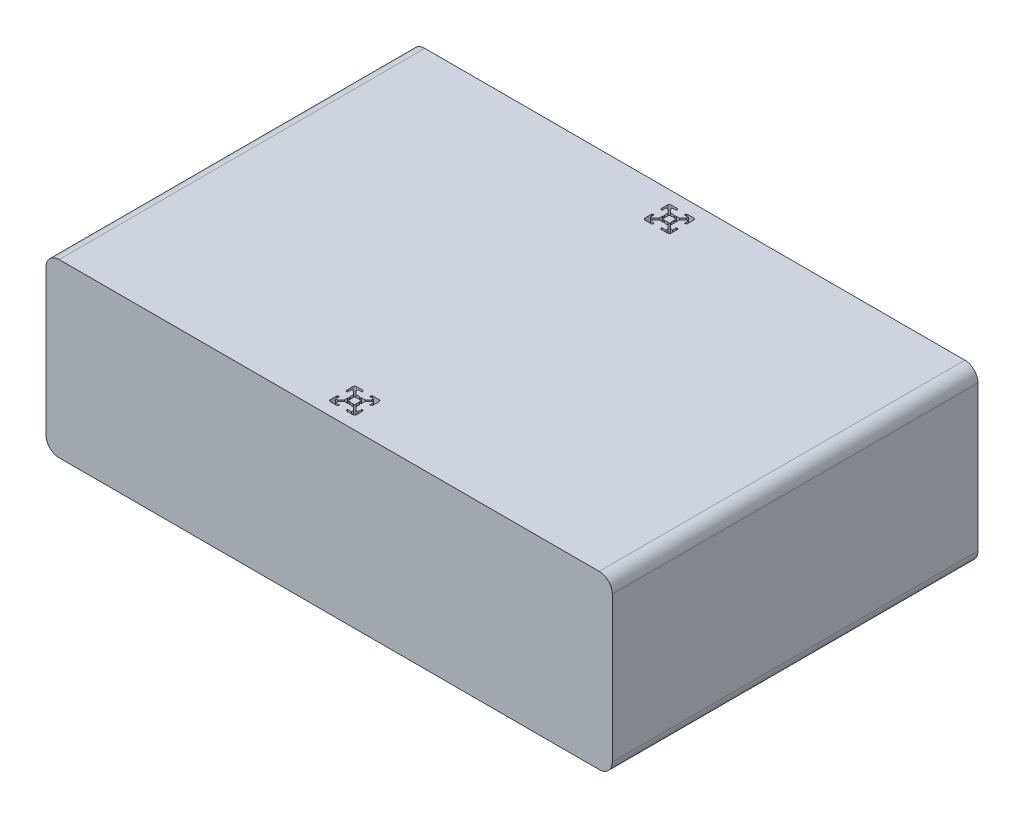
from build123d import *

# Parameters (mm, degrees)
ESQUISSE1_W             = 432
ESQUISSE1_H             = 279
BOSS_EXTRU_1_DEPTH      = 131
CONG_1_R                = 10
ENL_V_MAT_EXTRU_2_DEPTH = 100


with BuildPart() as part:
    # Esquisse1 → Boss.-Extru.1 (new body)
    with BuildSketch(Plane(origin=(0, 0, 0), x_dir=(1, 0, 0), z_dir=(0, 1, 0))):
        Rectangle(ESQUISSE1_W, ESQUISSE1_H)
    extrude(amount=BOSS_EXTRU_1_DEPTH)

    # Congé1
    cong_1_edges = [part.edges().sort_by_distance(p)[0] for p in [
        (-216, 131, 0),
        (216, 131, 0),
        (-216, 0, 0),
        (216, 0, 0),
    ]]
    fillet(cong_1_edges, radius=CONG_1_R)

    # Esquisse3 → Enlèv. mat.-Extru.2 (cut)
    # profile 1 of 2: a face of its own
    with BuildSketch(Plane(origin=(0, 131, 0), x_dir=(1, 0, 0), z_dir=(0, 1, 0))):
        with BuildLine():
            Line((-10, 116.5), (-10, 111.5))
            ThreePointArc((-10, 111.5), (-9.560660172, 110.439339828), (-8.5, 110))
            Line((-8.5, 110), (-3.5, 110))
            Line((-3.5, 110), (-3.5, 110.5))
            Line((-3.5, 110.5), (-3, 110.5))
            Line((-3, 110.5), (-3, 111.5))
            Line((-3, 111.5), (-6, 111.5))
            Line((-6, 111.5), (-6, 112.939339828))
            Line((-6, 112.939339828), (-3.439339828, 115.5))
            Line((-3.439339828, 115.5), (-0.866025404, 115.5))
            Line((-0.866025404, 115.5), (0, 116))
            Line((0, 116), (0.866025404, 115.5))
            Line((0.866025404, 115.5), (3.439339828, 115.5))
            Line((3.439339828, 115.5), (6, 112.939339828))
            Line((6, 112.939339828), (6, 111.5))
            Line((6, 111.5), (3, 111.5))
            Line((3, 111.5), (3, 110.5))
            Line((3, 110.5), (3.5, 110.5))
            Line((3.5, 110.5), (3.5, 110))
            Line((3.5, 110), (8.5, 110))
            ThreePointArc((8.5, 110), (9.560660172, 110.439339828), (10, 111.5))
            Line((10, 111.5), (10, 116.5))
            Line((10, 116.5), (9.5, 116.5))
            Line((9.5, 116.5), (9.5, 117))
            Line((9.5, 117), (8.5, 117))
            Line((8.5, 117), (8.5, 114))
            Line((8.5, 114), (7.060660172, 114))
            Line((7.060660172, 114), (4.5, 116.560660172))
            Line((4.5, 116.560660172), (4.5, 119.133974596))
            Line((4.5, 119.133974596), (4, 120))
            Line((4, 120), (4.5, 120.866025404))
            Line((4.5, 120.866025404), (4.5, 123.439339828))
            Line((4.5, 123.439339828), (7.060660172, 126))
            Line((7.060660172, 126), (8.5, 126))
            Line((8.5, 126), (8.5, 123))
            Line((8.5, 123), (9.5, 123))
            Line((9.5, 123), (9.5, 123.5))
            Line((9.5, 123.5), (10, 123.5))
            Line((10, 123.5), (10, 128.5))
            ThreePointArc((10, 128.5), (9.560660172, 129.560660172), (8.5, 130))
            Line((8.5, 130), (3.5, 130))
            Line((3.5, 130), (3.5, 129.5))
            Line((3.5, 129.5), (3, 129.5))
            Line((3, 129.5), (3, 128.5))
            Line((3, 128.5), (6, 128.5))
            Line((6, 128.5), (6, 127.060660172))
            Line((6, 127.060660172), (3.439339828, 124.5))
            Line((3.439339828, 124.5), (0.866025404, 124.5))
            Line((0.866025404, 124.5), (0, 124))
            Line((0, 124), (-0.866025404, 124.5))
            Line((-0.866025404, 124.5), (-3.439339828, 124.5))
            Line((-3.439339828, 124.5), (-6, 127.060660172))
            Line((-6, 127.060660172), (-6, 128.5))
            Line((-6, 128.5), (-3, 128.5))
            Line((-3, 128.5), (-3, 129.5))
            Line((-3, 129.5), (-3.5, 129.5))
            Line((-3.5, 129.5), (-3.5, 130))
            Line((-3.5, 130), (-8.5, 130))
            ThreePointArc((-8.5, 130), (-9.560660172, 129.560660172), (-10, 128.5))
            Line((-10, 128.5), (-10, 123.5))
            Line((-10, 123.5), (-9.5, 123.5))
            Line((-9.5, 123.5), (-9.5, 123))
            Line((-9.5, 123), (-8.5, 123))
            Line((-8.5, 123), (-8.5, 126))
            Line((-8.5, 126), (-7.060660172, 126))
            Line((-7.060660172, 126), (-4.5, 123.439339828))
            Line((-4.5, 123.439339828), (-4.5, 120.866025404))
            Line((-4.5, 120.866025404), (-4, 120))
            Line((-4, 120), (-4.5, 119.133974596))
            Line((-4.5, 119.133974596), (-4.5, 116.560660172))
            Line((-4.5, 116.560660172), (-7.060660172, 114))
            Line((-7.060660172, 114), (-8.5, 114))
            Line((-8.5, 114), (-8.5, 117))
            Line((-8.5, 117), (-9.5, 117))
            Line((-9.5, 117), (-9.5, 116.5))
            Line((-9.5, 116.5), (-10, 116.5))
        make_face()
        with BuildLine():
            Line((-3.000876196, 121.949592103), (-2.435900169, 121.276279893))
            ThreePointArc((-2.435900169, 121.276279893), (-2.749999439, 120.001756003), (-2.43752811, 118.726832018))
            Line((-2.43752811, 118.726832018), (-3.003181207, 118.052712908))
            Line((-3.003181207, 118.052712908), (-1.949592103, 116.999123804))
            Line((-1.949592103, 116.999123804), (-1.276279893, 117.564099831))
            ThreePointArc((-1.276279893, 117.564099831), (-0.001756003, 117.250000561), (1.273167982, 117.56247189))
            Line((1.273167982, 117.56247189), (1.947287092, 116.996818793))
            Line((1.947287092, 116.996818793), (3.000876196, 118.050407897))
            Line((3.000876196, 118.050407897), (2.435900169, 118.723720107))
            ThreePointArc((2.435900169, 118.723720107), (2.749999439, 119.998243997), (2.43752811, 121.273167982))
            Line((2.43752811, 121.273167982), (3.003181207, 121.947287092))
            Line((3.003181207, 121.947287092), (1.949592103, 123.000876196))
            Line((1.949592103, 123.000876196), (1.276279893, 122.435900169))
            ThreePointArc((1.276279893, 122.435900169), (0.001756003, 122.749999439), (-1.273167982, 122.43752811))
            Line((-1.273167982, 122.43752811), (-1.947287092, 123.003181207))
            Line((-1.947287092, 123.003181207), (-3.000876196, 121.949592103))
        make_face(mode=Mode.SUBTRACT)
    # profile 2 of 2: a face of its own
    with BuildSketch(Plane(origin=(0, 131, 0), x_dir=(1, 0, 0), z_dir=(0, 1, 0))):
        with BuildLine():
            Line((-10, -123.5), (-10, -128.5))
            ThreePointArc((-10, -128.5), (-9.560660172, -129.560660172), (-8.5, -130))
            Line((-8.5, -130), (-3.5, -130))
            Line((-3.5, -130), (-3.5, -129.5))
            Line((-3.5, -129.5), (-3, -129.5))
            Line((-3, -129.5), (-3, -128.5))
            Line((-3, -128.5), (-6, -128.5))
            Line((-6, -128.5), (-6, -127.060660172))
            Line((-6, -127.060660172), (-3.439339828, -124.5))
            Line((-3.439339828, -124.5), (-0.866025404, -124.5))
            Line((-0.866025404, -124.5), (0, -124))
            Line((0, -124), (0.866025404, -124.5))
            Line((0.866025404, -124.5), (3.439339828, -124.5))
            Line((3.439339828, -124.5), (6, -127.060660172))
            Line((6, -127.060660172), (6, -128.5))
            Line((6, -128.5), (3, -128.5))
            Line((3, -128.5), (3, -129.5))
            Line((3, -129.5), (3.5, -129.5))
            Line((3.5, -129.5), (3.5, -130))
            Line((3.5, -130), (8.5, -130))
            ThreePointArc((8.5, -130), (9.560660172, -129.560660172), (10, -128.5))
            Line((10, -128.5), (10, -123.5))
            Line((10, -123.5), (9.5, -123.5))
            Line((9.5, -123.5), (9.5, -123))
            Line((9.5, -123), (8.5, -123))
            Line((8.5, -123), (8.5, -126))
            Line((8.5, -126), (7.060660172, -126))
            Line((7.060660172, -126), (4.5, -123.439339828))
            Line((4.5, -123.439339828), (4.5, -120.866025404))
            Line((4.5, -120.866025404), (4, -120))
            Line((4, -120), (4.5, -119.133974596))
            Line((4.5, -119.133974596), (4.5, -116.560660172))
            Line((4.5, -116.560660172), (7.060660172, -114))
            Line((7.060660172, -114), (8.5, -114))
            Line((8.5, -114), (8.5, -117))
            Line((8.5, -117), (9.5, -117))
            Line((9.5, -117), (9.5, -116.5))
            Line((9.5, -116.5), (10, -116.5))
            Line((10, -116.5), (10, -111.5))
            ThreePointArc((10, -111.5), (9.560660172, -110.439339828), (8.5, -110))
            Line((8.5, -110), (3.5, -110))
            Line((3.5, -110), (3.5, -110.5))
            Line((3.5, -110.5), (3, -110.5))
            Line((3, -110.5), (3, -111.5))
            Line((3, -111.5), (6, -111.5))
            Line((6, -111.5), (6, -112.939339828))
            Line((6, -112.939339828), (3.439339828, -115.5))
            Line((3.439339828, -115.5), (0.866025404, -115.5))
            Line((0.866025404, -115.5), (0, -116))
            Line((0, -116), (-0.866025404, -115.5))
            Line((-0.866025404, -115.5), (-3.439339828, -115.5))
            Line((-3.439339828, -115.5), (-6, -112.939339828))
            Line((-6, -112.939339828), (-6, -111.5))
            Line((-6, -111.5), (-3, -111.5))
            Line((-3, -111.5), (-3, -110.5))
            Line((-3, -110.5), (-3.5, -110.5))
            Line((-3.5, -110.5), (-3.5, -110))
            Line((-3.5, -110), (-8.5, -110))
            ThreePointArc((-8.5, -110), (-9.560660172, -110.439339828), (-10, -111.5))
            Line((-10, -111.5), (-10, -116.5))
            Line((-10, -116.5), (-9.5, -116.5))
            Line((-9.5, -116.5), (-9.5, -117))
            Line((-9.5, -117), (-8.5, -117))
            Line((-8.5, -117), (-8.5, -114))
            Line((-8.5, -114), (-7.060660172, -114))
            Line((-7.060660172, -114), (-4.5, -116.560660172))
            Line((-4.5, -116.560660172), (-4.5, -119.133974596))
            Line((-4.5, -119.133974596), (-4, -120))
            Line((-4, -120), (-4.5, -120.866025404))
            Line((-4.5, -120.866025404), (-4.5, -123.439339828))
            Line((-4.5, -123.439339828), (-7.060660172, -126))
            Line((-7.060660172, -126), (-8.5, -126))
            Line((-8.5, -126), (-8.5, -123))
            Line((-8.5, -123), (-9.5, -123))
            Line((-9.5, -123), (-9.5, -123.5))
            Line((-9.5, -123.5), (-10, -123.5))
        make_face()
        with BuildLine():
            Line((-3.000876196, -118.050407897), (-2.435900169, -118.723720107))
            ThreePointArc((-2.435900169, -118.723720107), (-2.749999439, -119.998243997), (-2.43752811, -121.273167982))
            Line((-2.43752811, -121.273167982), (-3.003181207, -121.947287092))
            Line((-3.003181207, -121.947287092), (-1.949592103, -123.000876196))
            Line((-1.949592103, -123.000876196), (-1.276279893, -122.435900169))
            ThreePointArc((-1.276279893, -122.435900169), (-0.001756003, -122.749999439), (1.273167982, -122.43752811))
            Line((1.273167982, -122.43752811), (1.947287092, -123.003181207))
            Line((1.947287092, -123.003181207), (3.000876196, -121.949592103))
            Line((3.000876196, -121.949592103), (2.435900169, -121.276279893))
            ThreePointArc((2.435900169, -121.276279893), (2.749999439, -120.001756003), (2.43752811, -118.726832018))
            Line((2.43752811, -118.726832018), (3.003181207, -118.052712908))
            Line((3.003181207, -118.052712908), (1.949592103, -116.999123804))
            Line((1.949592103, -116.999123804), (1.276279893, -117.564099831))
            ThreePointArc((1.276279893, -117.564099831), (0.001756003, -117.250000561), (-1.273167982, -117.56247189))
            Line((-1.273167982, -117.56247189), (-1.947287092, -116.996818793))
            Line((-1.947287092, -116.996818793), (-3.000876196, -118.050407897))
        make_face(mode=Mode.SUBTRACT)
    extrude(amount=-ENL_V_MAT_EXTRU_2_DEPTH, mode=Mode.SUBTRACT)


solid = part.part
